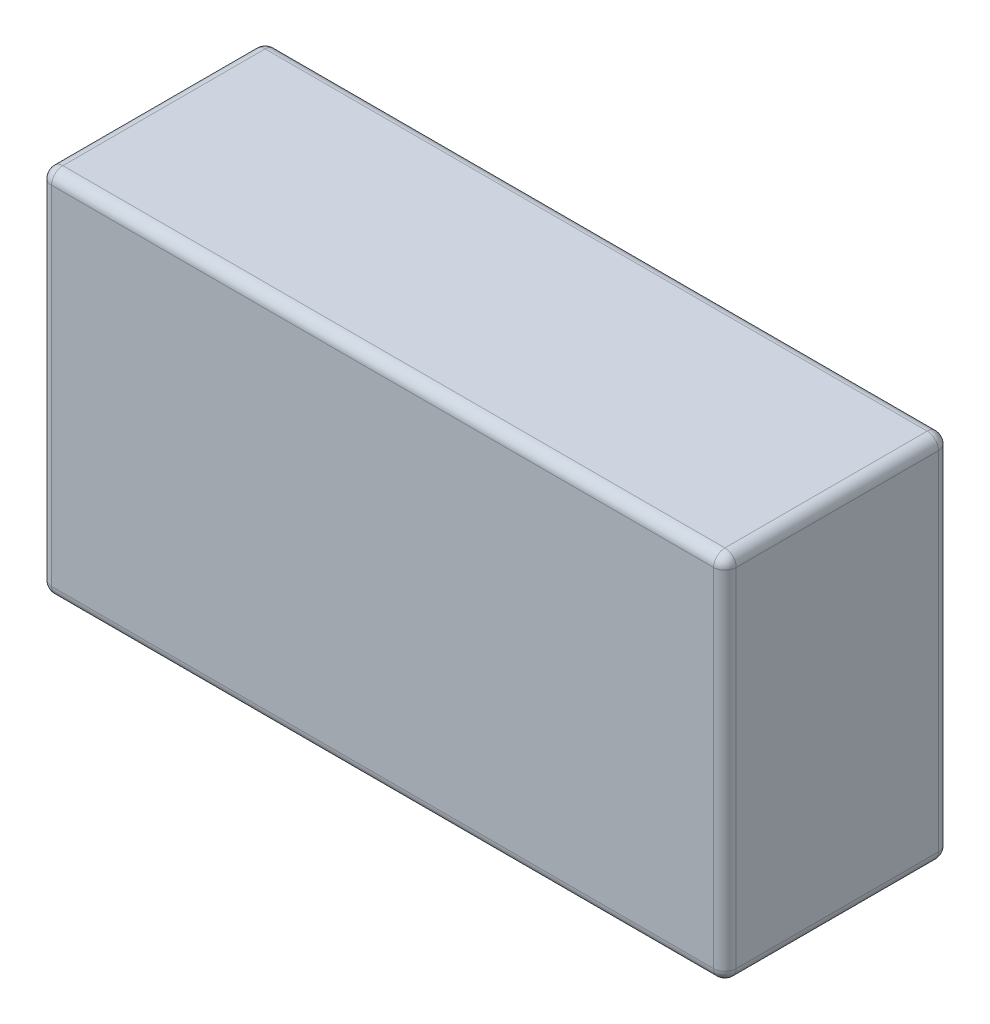
from build123d import *

# Parameters (mm, degrees)
SKETCH1_W           = 121.2
SKETCH1_H           = 65.5
BOSS_EXTRUDE1_DEPTH = 39.8
FILLET1_R           = 2


with BuildPart() as part:
    # Sketch1 → Boss-Extrude1 (new body)
    with BuildSketch(Plane.XY):
        with Locations((60.6, 32.75)):
            Rectangle(SKETCH1_W, SKETCH1_H)
    extrude(amount=BOSS_EXTRUDE1_DEPTH)

    # Fillet1
    fillet1_edges = [part.edges().sort_by_distance(p)[0] for p in [
        (121.2, 32.75, 39.8),
        (60.6, 0, 39.8),
        (0, 32.75, 39.8),
        (60.6, 0, 0),
        (121.2, 32.75, 0),
        (60.6, 65.5, 0),
        (0, 32.75, 0),
        (60.6, 65.5, 39.8),
        (0, 0, 19.9),
        (121.2, 0, 19.9),
        (121.2, 65.5, 19.9),
        (0, 65.5, 19.9),
    ]]
    fillet(fillet1_edges, radius=FILLET1_R)


solid = part.part
